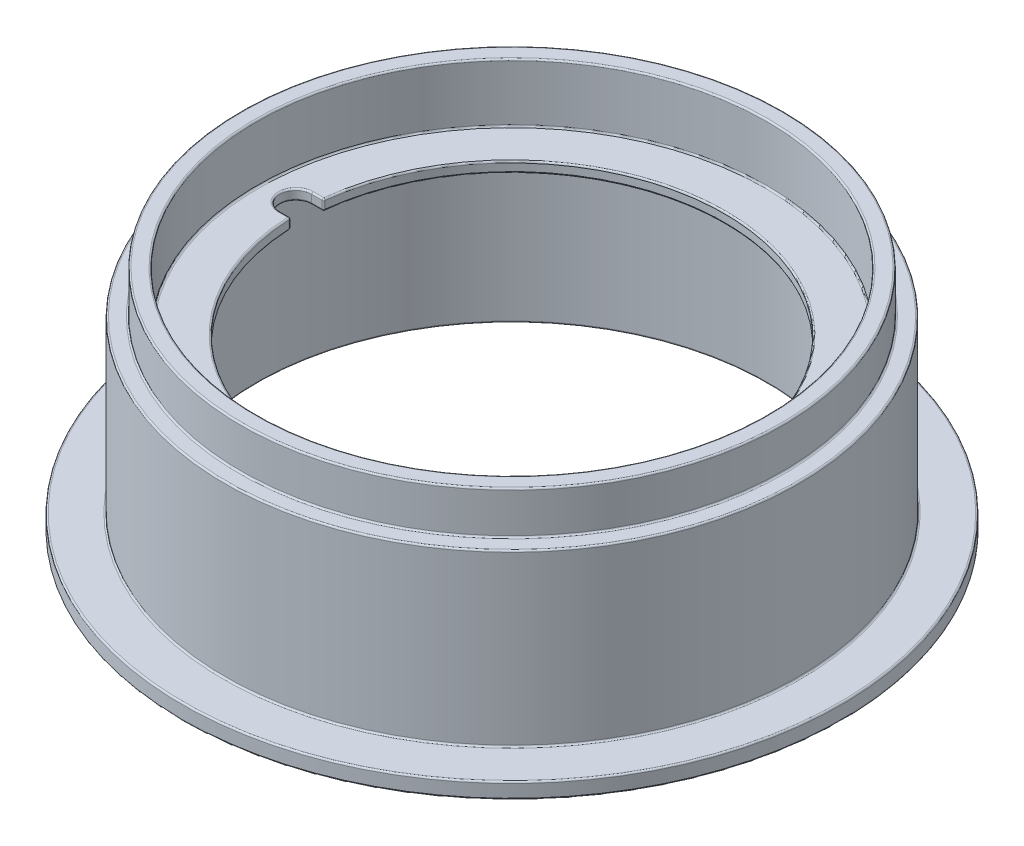
from build123d import *

# Parameters (mm, degrees)
CUT_EXTRUDE1_DEPTH = 8
FILLET1_R          = 0.075


with BuildPart() as part:
    # Sketch1 → Revolve1 (revolve)
    with BuildSketch(Plane.XY, mode=Mode.PRIVATE) as revolve1_sk:
        Polygon((-12, 0), (-15.5, 0), (-15.5, 0.75), (-13.5, 0.75), (-13.5, 8.75), (-12.75, 8.75), (-12.75, 10.75), (-12, 10.75), (-12, 8), (-10, 8), (-10, 7.5), (-12, 7.5), align=None)
    revolve(revolve1_sk.sketch.rotate(Axis((0, 0, 0), (0, 1, 0)), 270), axis=Axis((0, 0, 0), (0, 1, 0)))

    # Sketch2 → Cut-Extrude1 (cut)
    with BuildSketch(Plane(origin=(0, 0, 0), x_dir=(1, 0, 0), z_dir=(0, 1, 0))):
        with BuildLine():
            Line((-8.5, -0.418321687), (-8.5, 1.081678313))
            Line((-8.5, 1.081678313), (-10.5, 1.081678313))
            ThreePointArc((-10.5, 1.081678313), (-11.25, 0.331678313), (-10.5, -0.418321687))
            Line((-10.5, -0.418321687), (-8.5, -0.418321687))
        make_face()
        with BuildLine():
            Line((10.5, -0.418321687), (8.5, -0.418321687))
            Line((8.5, -0.418321687), (8.5, 1.081678313))
            Line((8.5, 1.081678313), (10.5, 1.081678313))
            ThreePointArc((10.5, 1.081678313), (11.25, 0.331678313), (10.5, -0.418321687))
        make_face()
    extrude(amount=CUT_EXTRUDE1_DEPTH, mode=Mode.SUBTRACT)

    # Fillet1
    fillet1_edges = [part.edges().sort_by_distance(p)[0] for p in [
        (0, 8, 12),
        (0, 10.75, 12),
        (0, 10.75, 12.75),
        (0, 8.75, 12.75),
        (0, 8.75, 13.5),
        (0, 0.75, 13.5),
        (0, 0.75, 15.5),
        (0, 0, 15.5),
        (0, 0, 12),
        (0, 7.5, 10),
        (0, 7.5, -10),
        (11.25, 7.5, -0.331678313),
        (10.220663236, 7.5, -1.081678313),
        (10.245623259, 7.5, 0.418321687),
        (-10.245623259, 7.5, 0.418321687),
        (-11.25, 7.5, -0.331678313),
        (-10.220663236, 7.5, -1.081678313),
        (0, 8, 10),
        (0, 8, -10),
        (-11.25, 8, -0.331678313),
        (-10.220663236, 8, -1.081678313),
        (-10.245623259, 8, 0.418321687),
        (-9.941326472, 7.75, -1.081678313),
        (-9.991246517, 7.75, 0.418321687),
        (10.245623259, 8, 0.418321687),
        (10.220663236, 8, -1.081678313),
        (11.25, 8, -0.331678313),
        (9.991246517, 7.75, 0.418321687),
        (9.941326472, 7.75, -1.081678313),
        (0, 7.5, 12),
    ]]
    fillet(fillet1_edges, radius=FILLET1_R)


solid = part.part
